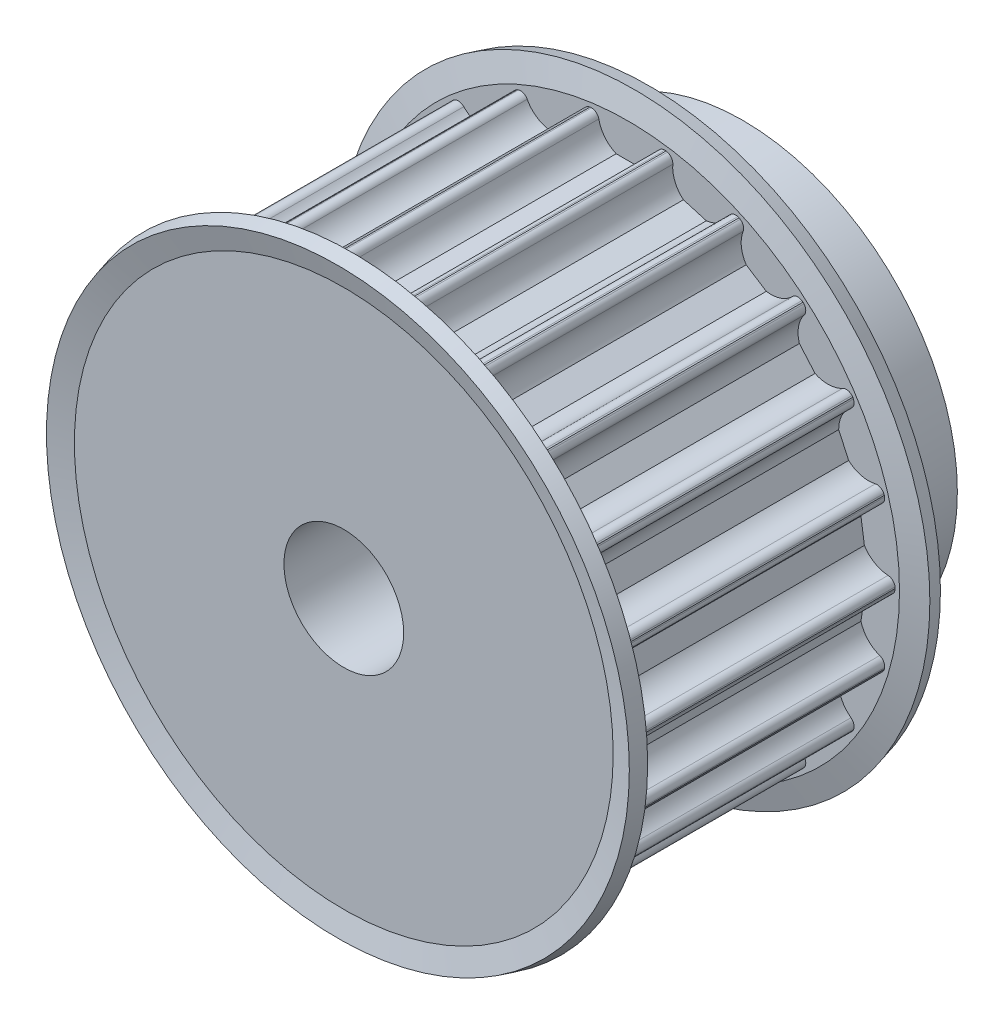
from build123d import *

# Parameters (mm, degrees)
CUT_EXTRUDE1_DEPTH = 56.543901555
CIRPATTERN1_COUNT  = 22


with BuildPart() as part:
    # Sketch1 → Revolve1 (revolve)
    with BuildSketch(Plane(origin=(0, 0, 0), x_dir=(0, 0, -1), z_dir=(1, 0, 0)), mode=Mode.PRIVATE) as revolve1_sk:
        Polygon((0, 6), (0, 27.25), (30, 27.25), (30, 21.5), (40, 21.5), (40, 6), align=None)
    revolve(revolve1_sk.sketch.rotate(Axis((0, 0, 55), (0, 0, -1)), 90), axis=Axis((0, 0, 55), (0, 0, -1)))

    # Sketch2 → Cut-Extrude1 (cut, through all)
    with BuildSketch(Plane.XY):
        with BuildLine():
            Line((3.674234614, 26.5), (4, 26.5))
            Line((4, 26.5), (4, 28.5))
            Line((4, 28.5), (-4, 28.5))
            Line((-4, 28.5), (-4, 26.5))
            Line((-4, 26.5), (-3.674234614, 26.5))
            ThreePointArc((-3.674234614, 26.5), (-3.199892965, 26.330947502), (-2.939387691, 25.9))
            ThreePointArc((-2.939387691, 25.9), (-2.331759211, 24.612435701), (-1.198957881, 23.75))
            Line((-1.198957881, 23.75), (1.198957881, 23.75))
            ThreePointArc((1.198957881, 23.75), (2.331759211, 24.612435701), (2.939387691, 25.9))
            ThreePointArc((2.939387691, 25.9), (3.199892965, 26.330947502), (3.674234614, 26.5))
        make_face()
    cut_extrude1 = extrude(amount=-CUT_EXTRUDE1_DEPTH, mode=Mode.SUBTRACT)

    # CirPattern1: Cut-Extrude1 ×22 about axis
    cirpattern1_axis = Axis((0, 0, 0), (0, 0, 1))
    for i in range(1, CIRPATTERN1_COUNT):
        add(cut_extrude1.rotate(cirpattern1_axis, i * 360 / CIRPATTERN1_COUNT), mode=Mode.SUBTRACT)

    # Sketch3 → Revolve2 (revolve)
    with BuildSketch(Plane(origin=(0, 0, 0), x_dir=(0, 0, -1), z_dir=(1, 0, 0)), mode=Mode.PRIVATE) as revolve2_sk:
        Polygon((0, 27.002521254), (0, 22.2), (1.5, 22.2), (1.5, 27.2), (0.856921938, 29.6), (-0.591966801, 29.211771432), align=None)
        Polygon((30.591966801, 29.211771432), (29.143078062, 29.6), (28.5, 27.2), (28.5, 22.2), (30, 22.2), (30, 27.002521254), align=None)
    revolve(revolve2_sk.sketch.rotate(Axis((0, 0, 55), (0, 0, -1)), 90), axis=Axis((0, 0, 55), (0, 0, -1)))


solid = part.part
